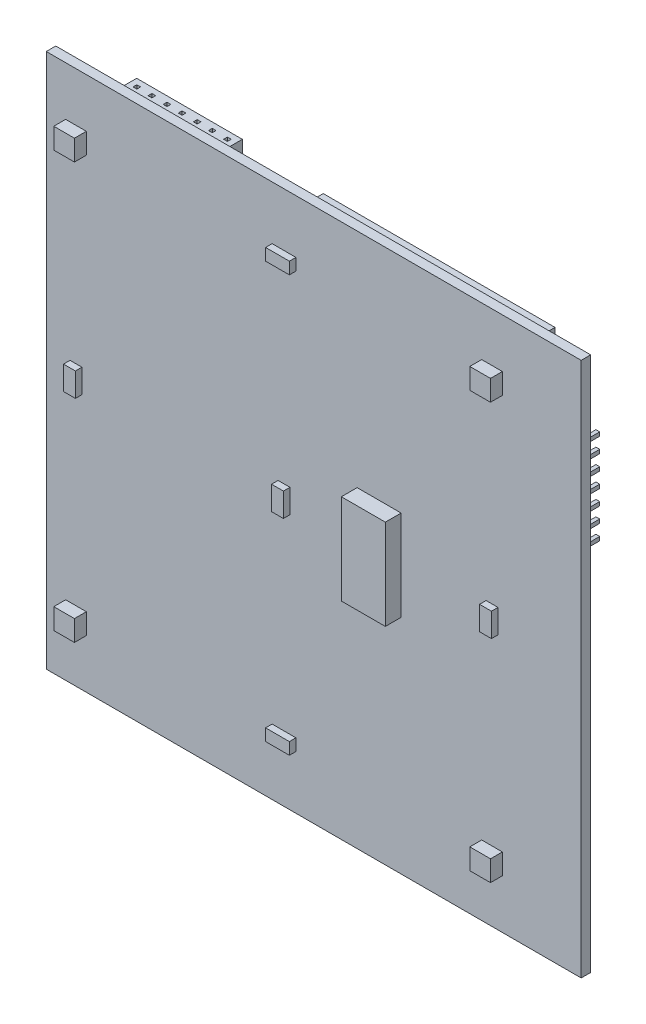
from build123d import *

# Parameters (mm, degrees)
SKETCH_1_W          = 90
SKETCH_1_H          = 90
EXTRUDE_1_DEPTH     = 1.6
SKETCH_4_W          = 17.78
SKETCH_4_H          = 8.5
SKETCH_4_W_2        = 2.5
SKETCH_4_H_2        = 17.78
SKETCH_4_W_3        = 8.5
EXTRUDE_2_DEPTH     = 2.5
SKETCH_5_W          = 0.64
SKETCH_5_H          = 0.64
EXTRUDE_3_DEPTH     = 6.1
SKETCH_6_W          = 3.48
SKETCH_6_H          = 3.48
EXTRUDE_4_DEPTH     = 2
SKETCH_7_W          = 2
SKETCH_7_H          = 4
SKETCH_7_W_2        = 4
SKETCH_7_H_2        = 2
EXTRUDE_5_DEPTH     = 1.1
SKETCH_8_W          = 7.4
SKETCH_8_H          = 15.2
EXTRUDE_6_DEPTH     = 2.65
SKETCH_9_W          = 0.64
SKETCH_9_H          = 0.64
CUT_EXTRUDE_1_DEPTH = 7.5
SKETCH_10_W         = 0.64
SKETCH_10_H         = 0.64
CUT_EXTRUDE_2_DEPTH = 7.5
SKETCH_11_W         = 0.64
SKETCH_11_H         = 0.64
CUT_EXTRUDE_3_DEPTH = 7.5
EXTRUDE_7_DEPTH     = 3
SKETCH_13_R         = 1
EXTRUDE_8_DEPTH     = 2


with BuildPart() as part:
    # ｽｹｯﾁ1 → ﾎﾞｽ - 押し出し1 (new body)
    with BuildSketch(Plane.XY):
        Rectangle(SKETCH_1_W, SKETCH_1_H)
    extrude(amount=EXTRUDE_1_DEPTH)

    # ｽｹｯﾁ4 → ﾎﾞｽ - 押し出し2 (add)
    with BuildSketch(Plane(origin=(0, 0, 0), x_dir=(-1, 0, 0), z_dir=(0, 0, -1))):
        with Locations((-15, -40.35)):
            Rectangle(SKETCH_4_W, SKETCH_4_H)
        with Locations((-37.6, 18)):
            Rectangle(SKETCH_4_W_2, SKETCH_4_H_2)
        with Locations((25, 40.35)):
            Rectangle(SKETCH_4_W, SKETCH_4_H)
        with Locations((40.35, 18)):
            Rectangle(SKETCH_4_W_3, SKETCH_4_H_2)
    extrude(amount=EXTRUDE_2_DEPTH)

    # ｽｹｯﾁ5 → ﾎﾞｽ - 押し出し3 (add)
    with BuildSketch(Plane(origin=(0, 0, -2.5), x_dir=(-1, 0, 0), z_dir=(0, 0, -1))):
        with Locations((-37.6, 18)):
            Rectangle(SKETCH_5_W, SKETCH_5_H)
        with Locations((-37.6, 15.46)):
            Rectangle(SKETCH_5_W, SKETCH_5_H)
        with Locations((-37.6, 12.92)):
            Rectangle(SKETCH_5_W, SKETCH_5_H)
        with Locations((-37.6, 10.38)):
            Rectangle(SKETCH_5_W, SKETCH_5_H)
        with Locations((-37.6, 20.54)):
            Rectangle(SKETCH_5_W, SKETCH_5_H)
        with Locations((-37.6, 23.08)):
            Rectangle(SKETCH_5_W, SKETCH_5_H)
        with Locations((-37.6, 25.62)):
            Rectangle(SKETCH_5_W, SKETCH_5_H)
    extrude(amount=EXTRUDE_3_DEPTH)

    # ｽｹｯﾁ6 → ﾎﾞｽ - 押し出し4 (add)
    with BuildSketch(Plane.XY.offset(1.6)):
        with Locations((-40, -35)):
            Rectangle(SKETCH_6_W, SKETCH_6_H)
        with Locations((-40, 35)):
            Rectangle(SKETCH_6_W, SKETCH_6_H)
        with Locations((30, -35)):
            Rectangle(SKETCH_6_W, SKETCH_6_H)
        with Locations((30, 35)):
            Rectangle(SKETCH_6_W, SKETCH_6_H)
    extrude(amount=EXTRUDE_4_DEPTH)

    # ｽｹｯﾁ7 → ﾎﾞｽ - 押し出し5 (add)
    with BuildSketch(Plane.XY.offset(1.6)):
        with Locations((-40, 0)):
            Rectangle(SKETCH_7_W, SKETCH_7_H)
        with Locations((30, 0)):
            Rectangle(SKETCH_7_W, SKETCH_7_H)
        with Locations((-5, 35)):
            Rectangle(SKETCH_7_W_2, SKETCH_7_H_2)
        with Locations((-5, -35)):
            Rectangle(SKETCH_7_W_2, SKETCH_7_H_2)
        with Locations((-5, 0)):
            Rectangle(SKETCH_7_W, SKETCH_7_H)
    extrude(amount=EXTRUDE_5_DEPTH)

    # ｽｹｯﾁ8 → ﾎﾞｽ - 押し出し6 (add)
    with BuildSketch(Plane.XY.offset(1.6)):
        with Locations((11, 0)):
            Rectangle(SKETCH_8_W, SKETCH_8_H)
    extrude(amount=EXTRUDE_6_DEPTH)

    # ｽｹｯﾁ9 → ｶｯﾄ - 押し出し1 (cut)
    with BuildSketch(Plane.XZ.offset(44.6)):
        with Locations((15, -1.25)):
            Rectangle(SKETCH_9_W, SKETCH_9_H)
        with Locations((12.46, -1.25)):
            Rectangle(SKETCH_9_W, SKETCH_9_H)
        with Locations((9.92, -1.25)):
            Rectangle(SKETCH_9_W, SKETCH_9_H)
        with Locations((7.38, -1.25)):
            Rectangle(SKETCH_9_W, SKETCH_9_H)
        with Locations((17.54, -1.25)):
            Rectangle(SKETCH_9_W, SKETCH_9_H)
        with Locations((20.08, -1.25)):
            Rectangle(SKETCH_9_W, SKETCH_9_H)
        with Locations((22.62, -1.25)):
            Rectangle(SKETCH_9_W, SKETCH_9_H)
    extrude(amount=-CUT_EXTRUDE_1_DEPTH, mode=Mode.SUBTRACT)

    # ｽｹｯﾁ10 → ｶｯﾄ - 押し出し2 (cut)
    with BuildSketch(Plane.ZY.offset(44.6)):
        with Locations((-1.25, 18)):
            Rectangle(SKETCH_10_W, SKETCH_10_H)
        with Locations((-1.25, 25.62)):
            Rectangle(SKETCH_10_W, SKETCH_10_H)
        with Locations((-1.25, 23.08)):
            Rectangle(SKETCH_10_W, SKETCH_10_H)
        with Locations((-1.25, 20.54)):
            Rectangle(SKETCH_10_W, SKETCH_10_H)
        with Locations((-1.25, 15.46)):
            Rectangle(SKETCH_10_W, SKETCH_10_H)
        with Locations((-1.25, 12.92)):
            Rectangle(SKETCH_10_W, SKETCH_10_H)
        with Locations((-1.25, 10.38)):
            Rectangle(SKETCH_10_W, SKETCH_10_H)
    extrude(amount=-CUT_EXTRUDE_2_DEPTH, mode=Mode.SUBTRACT)

    # ｽｹｯﾁ11 → ｶｯﾄ - 押し出し3 (cut)
    with BuildSketch(Plane(origin=(0, 44.6, 0), x_dir=(1, 0, 0), z_dir=(0, 1, 0))):
        with Locations((-25, 1.25)):
            Rectangle(SKETCH_11_W, SKETCH_11_H)
        with Locations((-32.62, 1.25)):
            Rectangle(SKETCH_11_W, SKETCH_11_H)
        with Locations((-30.08, 1.25)):
            Rectangle(SKETCH_11_W, SKETCH_11_H)
        with Locations((-27.54, 1.25)):
            Rectangle(SKETCH_11_W, SKETCH_11_H)
        with Locations((-22.46, 1.25)):
            Rectangle(SKETCH_11_W, SKETCH_11_H)
        with Locations((-19.92, 1.25)):
            Rectangle(SKETCH_11_W, SKETCH_11_H)
        with Locations((-17.38, 1.25)):
            Rectangle(SKETCH_11_W, SKETCH_11_H)
    extrude(amount=-CUT_EXTRUDE_3_DEPTH, mode=Mode.SUBTRACT)

    # ｽｹｯﾁ12 → ﾎﾞｽ - 押し出し7 (add)
    with BuildSketch(Plane(origin=(0, 0, 0), x_dir=(-1, 0, 0), z_dir=(0, 0, -1))):
        Polygon((-23, 30), (-24, 31.732050808), (-26, 31.732050808), (-27, 30), (-26, 28.267949192), (-24, 28.267949192), align=None)
        Polygon((37, 30), (36, 31.732050808), (34, 31.732050808), (33, 30), (34, 28.267949192), (36, 28.267949192), align=None)
        Polygon((37, -30), (36, -28.267949192), (34, -28.267949192), (33, -30), (34, -31.732050808), (36, -31.732050808), align=None)
        Polygon((-23, -30), (-24, -28.267949192), (-26, -28.267949192), (-27, -30), (-26, -31.732050808), (-24, -31.732050808), align=None)
    extrude(amount=EXTRUDE_7_DEPTH)


with BuildPart() as body_2:
    # ｽｹｯﾁ13 → ﾎﾞｽ - 押し出し8 (new body)
    with BuildSketch(Plane(origin=(0, 0, -3), x_dir=(-1, 0, 0), z_dir=(0, 0, -1))):
        Polygon((-34, 41), (-34, 0), (-36, 0), (-36, -39), (5, -39), (5, -41), (44, -41), (44, 0), (46, 0), (46, 39), (5, 39), (5, 41), align=None)
        with Locations((-25, 30)):
            Circle(SKETCH_13_R, mode=Mode.SUBTRACT)
        with Locations((-25, -30)):
            Circle(SKETCH_13_R, mode=Mode.SUBTRACT)
        with Locations((35, -30)):
            Circle(SKETCH_13_R, mode=Mode.SUBTRACT)
        with Locations((35, 30)):
            Circle(SKETCH_13_R, mode=Mode.SUBTRACT)
    extrude(amount=EXTRUDE_8_DEPTH)


solid = Compound([part.part, body_2.part])
